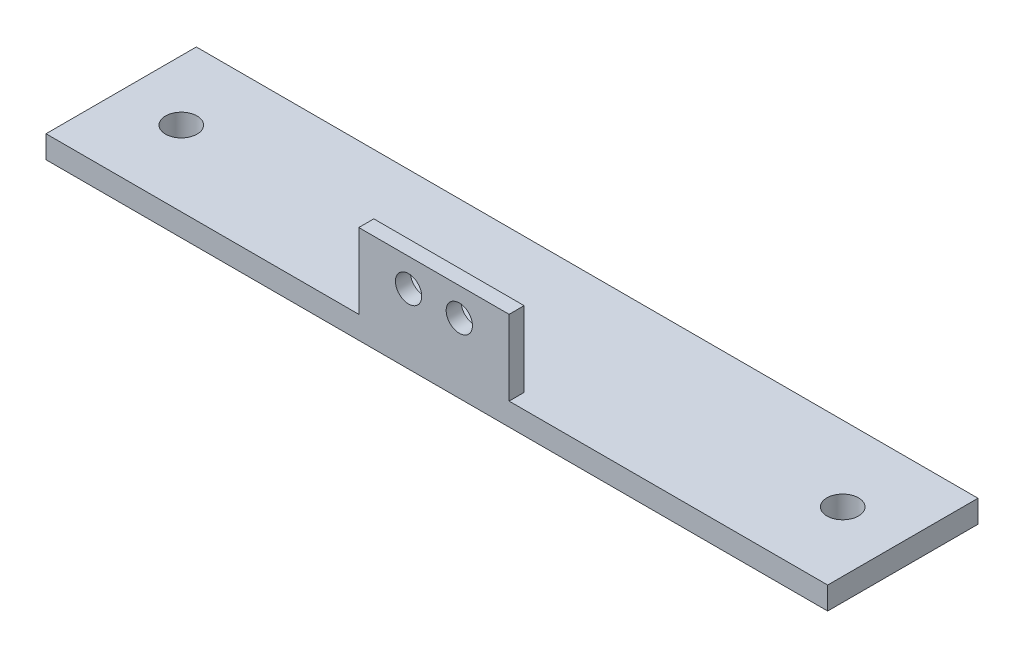
from build123d import *

# Parameters (mm, degrees)
ESQUISSE1_W             = 104
ESQUISSE1_H             = 20
ESQUISSE1_R             = 2.1
BOSS_EXTRU_1_DEPTH      = 3
BOSS_EXTRU_2_DEPTH      = 10
ESQUISSE3_R             = 1.75
ENL_V_MAT_EXTRU_1_DEPTH = 10


with BuildPart() as part:
    # Esquisse1 → Boss.-Extru.1 (new body)
    with BuildSketch(Plane(origin=(0, 0, 0), x_dir=(1, 0, 0), z_dir=(0, 1, 0))):
        with Locations((0.208658176, 10.165016502)):
            Rectangle(ESQUISSE1_W, ESQUISSE1_H)
        with Locations(Location((-43.791341824, 10.165016502, 0), (0, 0, 270))):
            Circle(ESQUISSE1_R, mode=Mode.SUBTRACT)
        with Locations(Location((44.208658176, 10.165016502, 0), (0, 0, 270))):
            Circle(ESQUISSE1_R, mode=Mode.SUBTRACT)
    extrude(amount=BOSS_EXTRU_1_DEPTH)

    # Esquisse2 → Boss.-Extru.2 (add)
    with BuildSketch(Plane(origin=(0, 3, 0), x_dir=(1, 0, 0), z_dir=(0, 1, 0))):
        Polygon((-0.177943938, 0.165016502), (-10.177943938, 0.165016502), (-10.177943938, 2.165016502), (9.822056062, 2.165016502), (9.822056062, 0.165016502), align=None)
    extrude(amount=BOSS_EXTRU_2_DEPTH)

    # Esquisse3 → Enlèv. mat.-Extru.1 (cut)
    with BuildSketch(Plane.XY.offset(-0.165016502)):
        with Locations((-3.552943938, 9.25)):
            Circle(ESQUISSE3_R)
        with Locations((3.197056062, 9.25)):
            Circle(ESQUISSE3_R)
    extrude(amount=-ENL_V_MAT_EXTRU_1_DEPTH, mode=Mode.SUBTRACT)


solid = part.part
